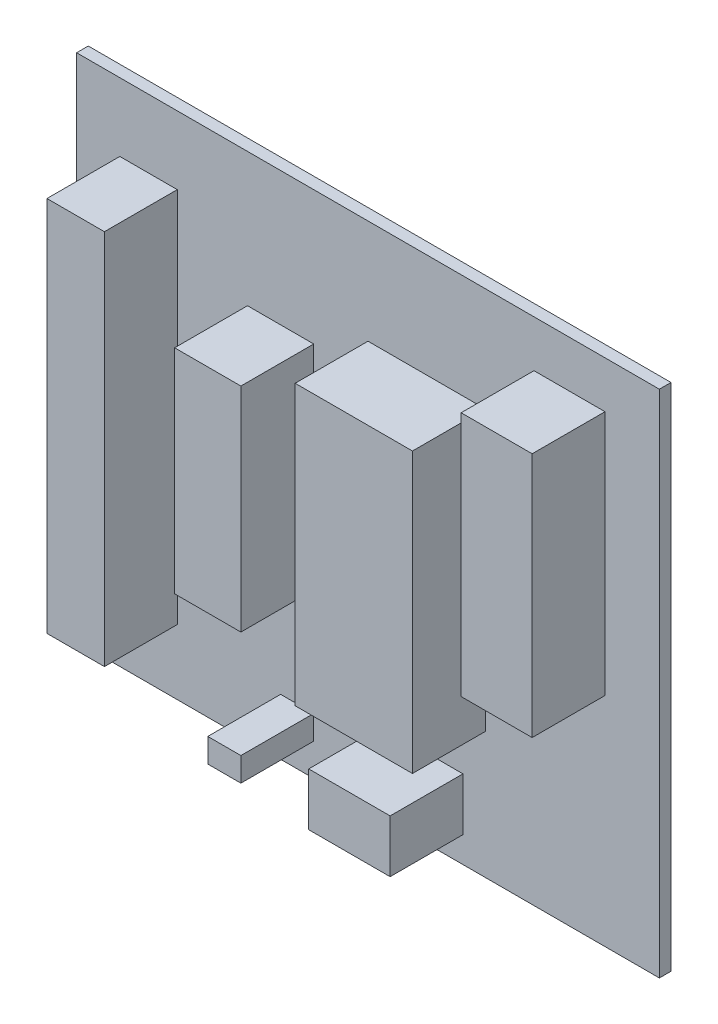
from build123d import *

# Parameters (mm, degrees)
SKETCH1_W           = 80
SKETCH1_H           = 70
BOSS_EXTRUDE1_DEPTH = 0.8
SKETCH2_W           = 9.092469125
SKETCH2_H           = 29.249268146
SKETCH2_W_2         = 16.103529653
SKETCH2_H_2         = 38.34173727
SKETCH2_W_3         = 7.887443096
SKETCH2_H_3         = 51.706571405
SKETCH2_W_4         = 9.749756049
SKETCH2_H_4         = 33.740728797
SKETCH2_W_5         = 4.546234562
SKETCH2_H_5         = 3.286434623
SKETCH2_W_6         = 11.173877719
SKETCH2_H_6         = 7.23015617
BOSS_EXTRUDE2_DEPTH = 10


with BuildPart() as part:
    # Sketch1 → Boss-Extrude1 (new, symmetric)
    with BuildSketch(Plane.XY):
        Rectangle(SKETCH1_W, SKETCH1_H)
    extrude(amount=BOSS_EXTRUDE1_DEPTH, both=True)

    # Sketch2 → Boss-Extrude2 (add)
    with BuildSketch(Plane.XY.offset(0.8)):
        with Locations((-11.995486375, 2.026634684)):
            Rectangle(SKETCH2_W, SKETCH2_H)
        with Locations((8.051764827, 1.533669491)):
            Rectangle(SKETCH2_W_2, SKETCH2_H_2)
        with Locations((-30.125650712, -0.219095641)):
            Rectangle(SKETCH2_W_3, SKETCH2_H_3)
        with Locations((27.660824745, 11.721616822)):
            Rectangle(SKETCH2_W_4, SKETCH2_H_4)
        with Locations((-9.722369093, -28.920624684)):
            Rectangle(SKETCH2_W_5, SKETCH2_H_5)
        with Locations((7.449251813, -27.825146476)):
            Rectangle(SKETCH2_W_6, SKETCH2_H_6)
    extrude(amount=BOSS_EXTRUDE2_DEPTH)


solid = part.part
